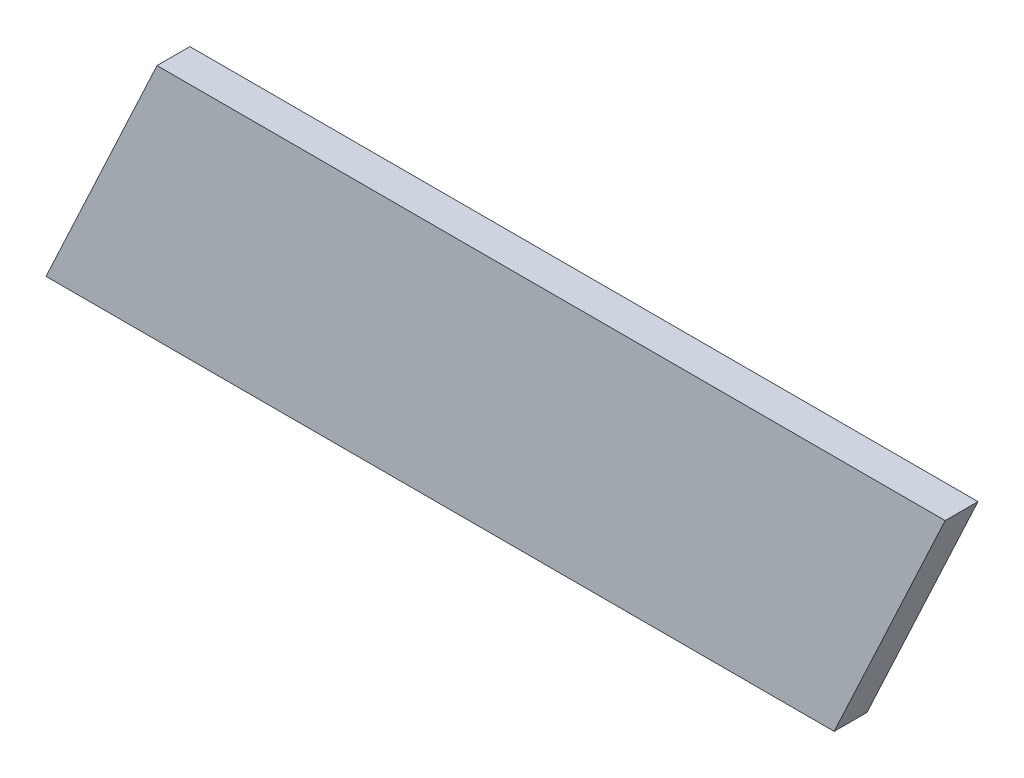
from build123d import *

# Parameters (mm, degrees)
BOSS_EXTRUDE1_DEPTH = 5


with BuildPart() as part:
    # Sketch1 → Boss-Extrude1 (new body)
    with BuildSketch(Plane.XY):
        Polygon((0, 0), (120, 0), (136.90473047, 36.252311481), (16.90473047, 36.252311481), align=None)
    extrude(amount=BOSS_EXTRUDE1_DEPTH)


solid = part.part
